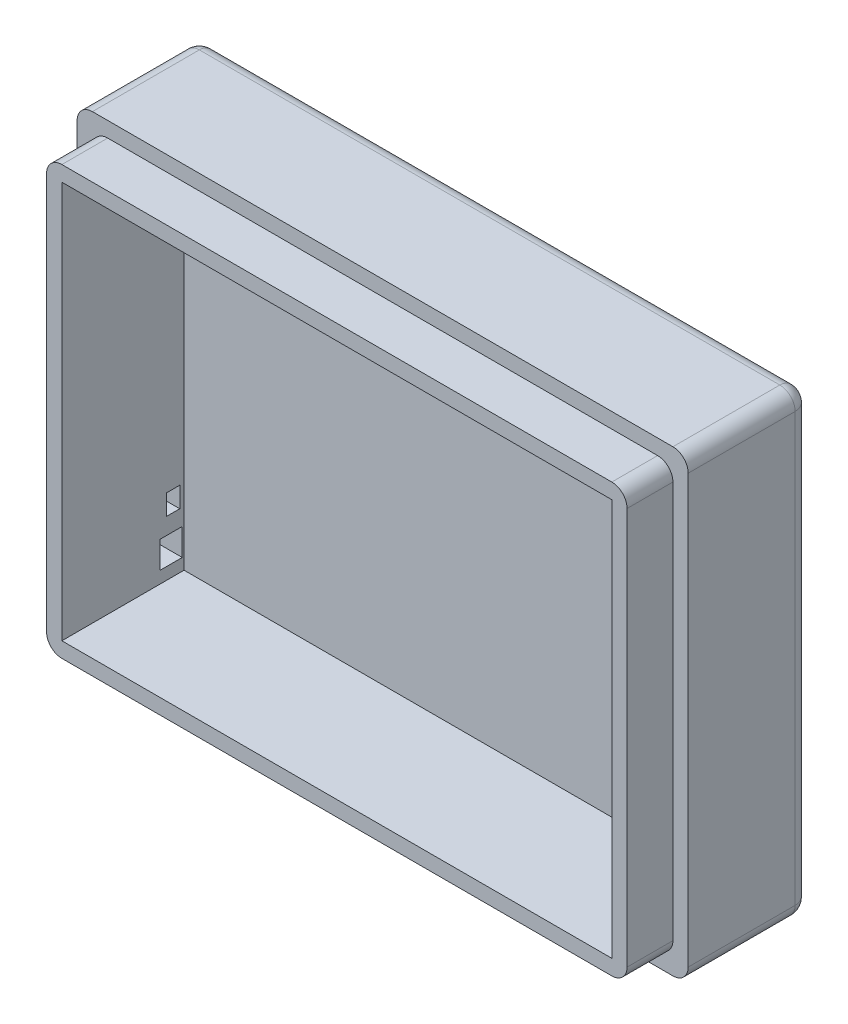
from build123d import *

# Parameters (mm, degrees)
SKETCH1_W           = 200
SKETCH1_H           = 150
BOSS_EXTRUDE1_DEPTH = 40
SKETCH2_R           = 6.084502499
SKETCH2_R_2         = 2.8
SKETCH2_W           = 71.985061483
SKETCH2_H           = 18.319551575
CUT_EXTRUDE1_DEPTH  = 7
SKETCH4_W           = 190
SKETCH4_H           = 140
CUT_EXTRUDE2_DEPTH  = 25
SKETCH5_W           = 190
SKETCH5_H           = 140
BOSS_EXTRUDE2_DEPTH = 40
SKETCH6_W           = 180
SKETCH6_H           = 130
CUT_EXTRUDE3_DEPTH  = 40
FILLET1_R           = 5
FILLET2_R           = 1.5
SKETCH7_R           = 6.084502499
BOSS_EXTRUDE3_DEPTH = 7
FILLET3_R           = 1.5
SKETCH9_R           = 0.791264775
CUT_EXTRUDE4_DEPTH  = 3
FILLET4_R           = 0.5
SKETCH10_R          = 2.5
BOSS_EXTRUDE4_DEPTH = 8.5
FILLET5_R           = 1.5
SKETCH13_W          = 70.985061483
SKETCH13_H          = 17.319551575
BOSS_EXTRUDE5_DEPTH = 6.5
FILLET6_R           = 1.5
SKETCH14_W          = 65.985061483
SKETCH14_H          = 12.319551575
CUT_EXTRUDE5_DEPTH  = 0.4
FILLET7_R           = 0.1
SKETCH15_W          = 7.208542358
SKETCH15_H          = 8.787380668
SKETCH15_W_2        = 4.351105625
SKETCH15_H_2        = 6.673379735
CUT_EXTRUDE6_DEPTH  = 50


with BuildPart() as part:
    # Sketch1 → Boss-Extrude1 (new body)
    with BuildSketch(Plane.XY):
        with Locations((-26.519337017, -4.55801105)):
            Rectangle(SKETCH1_W, SKETCH1_H)
    extrude(amount=BOSS_EXTRUDE1_DEPTH)

    # Sketch2 → Cut-Extrude1 (cut)
    with BuildSketch(Plane.XY):
        with Locations(Location((-41.606026549, -30.959717731, 0), (0, 0, 180))):
            Circle(SKETCH2_R)
        with Locations(Location((-57.770336762, -30.959717731, 0), (0, 0, 180))):
            Circle(SKETCH2_R_2)
        with Locations(Location((-69.408640116, -30.959717731, 0), (0, 0, 180))):
            Circle(SKETCH2_R_2)
        with Locations((10.981862679, -34.205370296)):
            Rectangle(SKETCH2_W, SKETCH2_H)
    extrude(amount=CUT_EXTRUDE1_DEPTH, mode=Mode.SUBTRACT)

    # Sketch4 → Cut-Extrude2 (cut)
    with BuildSketch(Plane.XY.offset(40)):
        with Locations((-26.519337017, -4.55801105)):
            Rectangle(SKETCH4_W, SKETCH4_H)
    extrude(amount=-CUT_EXTRUDE2_DEPTH, mode=Mode.SUBTRACT)

    # Sketch5 → Boss-Extrude2 (add)
    with BuildSketch(Plane.XY.offset(15)):
        with Locations((-26.519337017, -4.55801105)):
            Rectangle(SKETCH5_W, SKETCH5_H)
    extrude(amount=BOSS_EXTRUDE2_DEPTH)

    # Sketch6 → Cut-Extrude3 (cut)
    with BuildSketch(Plane.XY.offset(55)):
        with Locations((-26.519337017, -4.55801105)):
            Rectangle(SKETCH6_W, SKETCH6_H)
    extrude(amount=-CUT_EXTRUDE3_DEPTH, mode=Mode.SUBTRACT)

    # Fillet1
    fillet1_edges = [part.edges().sort_by_distance(p)[0] for p in [
        (-26.519337017, 70.44198895, 0),
        (73.480662983, -4.55801105, 0),
        (-121.519337017, 65.44198895, 47.5),
        (-121.519337017, -74.55801105, 47.5),
        (68.480662983, -74.55801105, 47.5),
        (68.480662983, 65.44198895, 47.5),
        (-26.519337017, -79.55801105, 0),
        (-126.519337017, -4.55801105, 0),
        (-126.519337017, 70.44198895, 20),
        (73.480662983, 70.44198895, 20),
        (73.480662983, -79.55801105, 20),
        (-126.519337017, -79.55801105, 20),
    ]]
    fillet(fillet1_edges, radius=FILLET1_R)

    # Fillet2
    fillet2_edges = [part.edges().sort_by_distance(p)[0] for p in [
        (10.981862678, -43.365146083, 0),
        (46.97439342, -34.205370296, 0),
        (10.981862678, -25.045594508, 0),
        (-35.52152405, -30.959717731, 0),
        (-54.970336762, -30.959717731, 0),
        (-66.608640116, -30.959717731, 0),
    ]]
    fillet(fillet2_edges, radius=FILLET2_R)

    # Sketch7 → Boss-Extrude3 (add)
    with BuildSketch(Plane(origin=(0, 0, 0), x_dir=(-1, 0, 0), z_dir=(0, 0, -1))):
        with Locations((41.606026549, -30.959717731)):
            Circle(SKETCH7_R)
    extrude(amount=-BOSS_EXTRUDE3_DEPTH)

    # Fillet3
    fillet3_edges = [part.edges().sort_by_distance(p)[0] for p in [
        (-25.010668063, -34.205370296, 0),
    ]]
    fillet(fillet3_edges, radius=FILLET3_R)

    # Sketch9 → Cut-Extrude4 (cut)
    with BuildSketch(Plane(origin=(0, 0, 0), x_dir=(-1, 0, 0), z_dir=(0, 0, -1))):
        with Locations((41.638967617, -30.959717731)):
            Circle(SKETCH9_R)
    extrude(amount=-CUT_EXTRUDE4_DEPTH, mode=Mode.SUBTRACT)

    # Fillet4
    fillet4_edges = [part.edges().sort_by_distance(p)[0] for p in [
        (-35.52152405, -30.959717731, 0),
    ]]
    fillet(fillet4_edges, radius=FILLET4_R)

    # Sketch10 → Boss-Extrude4 (add)
    with BuildSketch(Plane(origin=(0, 0, 7), x_dir=(-1, 0, 0), z_dir=(0, 0, -1))):
        with Locations(Location((57.770336762, -30.959717731, 0), (0, 0, 180))):
            Circle(SKETCH10_R)
        with Locations(Location((69.408640116, -30.959717731, 0), (0, 0, 180))):
            Circle(SKETCH10_R)
    extrude(amount=BOSS_EXTRUDE4_DEPTH)

    # Fillet5
    fillet5_edges = [part.edges().sort_by_distance(p)[0] for p in [
        (-71.908640116, -30.959717731, -1.5),
        (-60.270336762, -30.959717731, -1.5),
    ]]
    fillet(fillet5_edges, radius=FILLET5_R)

    # Sketch13 → Boss-Extrude5 (add)
    with BuildSketch(Plane(origin=(0, 0, 7), x_dir=(-1, 0, 0), z_dir=(0, 0, -1))):
        with Locations((-10.981862679, -34.205370296)):
            Rectangle(SKETCH13_W, SKETCH13_H)
    extrude(amount=BOSS_EXTRUDE5_DEPTH)

    # Fillet6
    fillet6_edges = [part.edges().sort_by_distance(p)[0] for p in [
        (46.47439342, -34.205370296, 0.5),
        (10.981862678, -42.865146083, 0.5),
        (-24.510668063, -34.205370296, 0.5),
        (10.981862678, -25.545594508, 0.5),
    ]]
    fillet(fillet6_edges, radius=FILLET6_R)

    # Sketch14 → Cut-Extrude5 (cut)
    with BuildSketch(Plane(origin=(0, 0, 0.5), x_dir=(-1, 0, 0), z_dir=(0, 0, -1))):
        with Locations((-10.981862679, -34.205370296)):
            Rectangle(SKETCH14_W, SKETCH14_H)
    extrude(amount=-CUT_EXTRUDE5_DEPTH, mode=Mode.SUBTRACT)

    # Fillet7
    fillet7_edges = [part.edges().sort_by_distance(p)[0] for p in [
        (43.97439342, -34.205370296, 0.5),
        (10.981862678, -40.365146083, 0.5),
        (-22.010668063, -34.205370296, 0.5),
        (10.981862678, -28.045594508, 0.5),
    ]]
    fillet(fillet7_edges, radius=FILLET7_R)

    # Sketch15 → Cut-Extrude6 (cut)
    with BuildSketch(Plane.ZY.offset(126.519337017)):
        with Locations((19.205658921, -61.249001282)):
            Rectangle(SKETCH15_W, SKETCH15_H)
        with Locations((18.590123015, -48.090072902)):
            Rectangle(SKETCH15_W_2, SKETCH15_H_2)
    extrude(amount=-CUT_EXTRUDE6_DEPTH, mode=Mode.SUBTRACT)


solid = part.part
